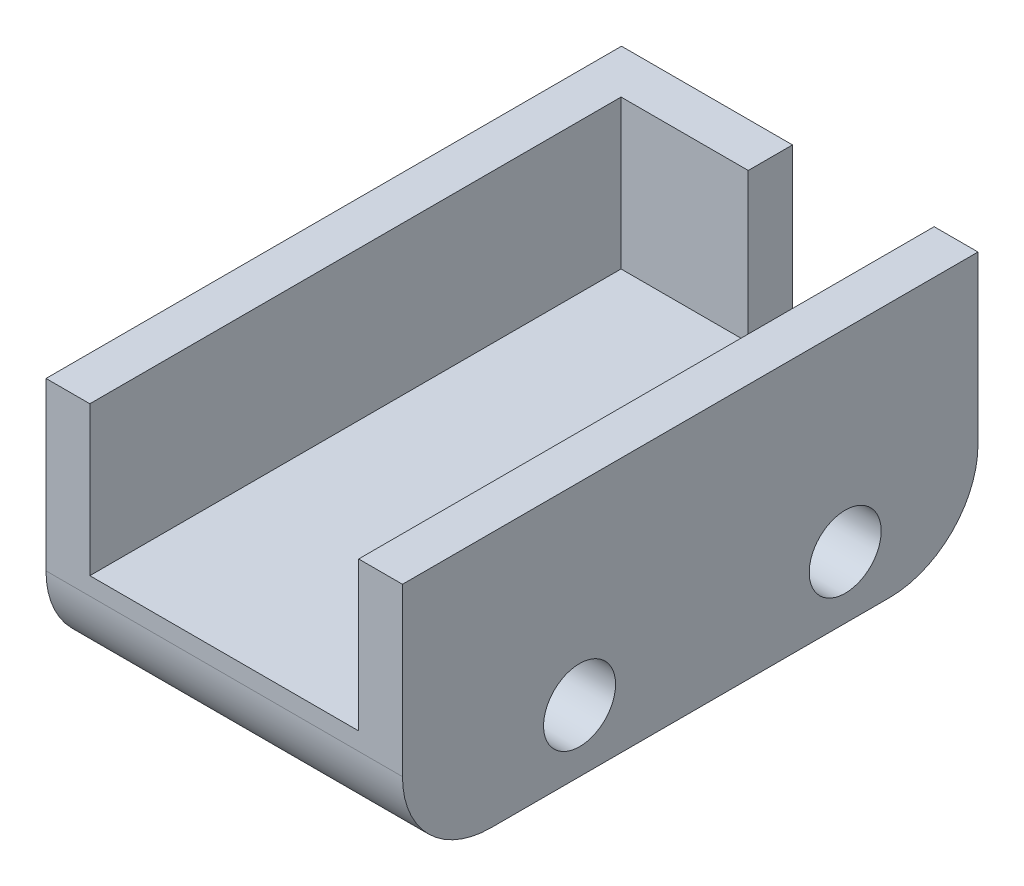
from build123d import *

# Parameters (mm, degrees)
ESQUISSE1_W               = 40.2629848
ESQUISSE1_H               = 26.817935246
BOSS_EXTRU_1_DEPTH        = 65
COQUE1_T                  = -1.5
COQUE1_THICKNESS_2_FACE_W = 63.5
COQUE1_THICKNESS_2_FACE_H = 25.317935246
COQUE1_THICKNESS_2_DEPTH  = 3.45
COQUE1_THICKNESS_3_FACE_W = 25.317935246
COQUE1_THICKNESS_3_FACE_H = 63.5
COQUE1_THICKNESS_3_DEPTH  = 3.45
COQUE1_THICKNESS_4_FACE_W = 63.5
COQUE1_THICKNESS_4_FACE_H = 30.3629848
COQUE1_THICKNESS_4_DEPTH  = 8.5
COQUE1_THICKNESS_5_FACE_W = 30.3629848
COQUE1_THICKNESS_5_FACE_H = 16.817935246
COQUE1_THICKNESS_5_DEPTH  = 3.5
ESQUISSE4_W               = 40.2629848
ESQUISSE4_H               = 65
BOSS_EXTRU_2_DEPTH        = 2
ESQUISSE5_R               = 4.065
ENL_V_MAT_EXTRU_3_DEPTH   = 82.026598076
CONG_2_R                  = 10
CONG_3_R                  = 10
ESQUISSE6_W               = 16
ESQUISSE6_H               = 16.817935246
ENL_V_MAT_EXTRU_4_DEPTH   = 78.073403946


with BuildPart() as part:
    # Esquisse1 → Boss.-Extru.1 (new body)
    with BuildSketch(Plane.XY):
        with Locations((20.1314924, 13.408967623)):
            Rectangle(ESQUISSE1_W, ESQUISSE1_H)
    extrude(amount=BOSS_EXTRU_1_DEPTH)

    # Coque1
    coque1_openings = [part.faces().sort_by_distance(p)[0] for p in [
        (20.1314924, 13.408967623, 65),
        (20.1314924, 26.817935246, 32.5),
    ]]
    offset(amount=COQUE1_T, openings=coque1_openings, kind=Kind.INTERSECTION)

    # Coque1 thickness 2 face (on inner face of the shell) → Coque1 thickness 2 (add)
    with BuildSketch(Plane(origin=(1.5, 14.158967623, 33.25), x_dir=(0, 0, -1), z_dir=(-1, 0, 0))):
        Rectangle(COQUE1_THICKNESS_2_FACE_W, COQUE1_THICKNESS_2_FACE_H)
    extrude(amount=-COQUE1_THICKNESS_2_DEPTH)

    # Coque1 thickness 3 face (on inner face of the shell) → Coque1 thickness 3 (add)
    with BuildSketch(Plane(origin=(38.7629848, 14.158967623, 33.25), x_dir=(0, 1, 0), z_dir=(1, 0, 0))):
        Rectangle(COQUE1_THICKNESS_3_FACE_W, COQUE1_THICKNESS_3_FACE_H)
    extrude(amount=-COQUE1_THICKNESS_3_DEPTH)

    # Coque1 thickness 4 face (on inner face of the shell) → Coque1 thickness 4 (add)
    with BuildSketch(Plane(origin=(20.1314924, 1.5, 33.25), x_dir=(0, 0, -1), z_dir=(0, -1, 0))):
        Rectangle(COQUE1_THICKNESS_4_FACE_W, COQUE1_THICKNESS_4_FACE_H)
    extrude(amount=-COQUE1_THICKNESS_4_DEPTH)

    # Coque1 thickness 5 face (on inner face of the shell) → Coque1 thickness 5 (add)
    with BuildSketch(Plane(origin=(20.1314924, 18.408967623, 1.5), x_dir=(-1, 0, 0), z_dir=(0, 0, -1))):
        Rectangle(COQUE1_THICKNESS_5_FACE_W, COQUE1_THICKNESS_5_FACE_H)
    extrude(amount=-COQUE1_THICKNESS_5_DEPTH)

    # Esquisse4 → Boss.-Extru.2 (add)
    with BuildSketch(Plane.XZ):
        with Locations((20.1314924, 32.5)):
            Rectangle(ESQUISSE4_W, ESQUISSE4_H)
    extrude(amount=BOSS_EXTRU_2_DEPTH)

    # Esquisse5 → Enlèv. mat.-Extru.3 (cut, through all)
    with BuildSketch(Plane(origin=(40.2629848, 0, 0), x_dir=(0, 0, -1), z_dir=(1, 0, 0))):
        with Locations((-15, 5)):
            Circle(ESQUISSE5_R)
        with Locations((-45, 5)):
            Circle(ESQUISSE5_R)
    extrude(amount=-ENL_V_MAT_EXTRU_3_DEPTH, mode=Mode.SUBTRACT)

    # Congé2
    cong_2_edges = [part.edges().sort_by_distance(p)[0] for p in [
        (20.1314924, -2, 0),
    ]]
    fillet(cong_2_edges, radius=CONG_2_R)

    # Congé3
    cong_3_edges = [part.edges().sort_by_distance(p)[0] for p in [
        (20.1314924, -2, 65),
    ]]
    fillet(cong_3_edges, radius=CONG_3_R)

    # Esquisse6 → Enlèv. mat.-Extru.4 (cut, through all)
    with BuildSketch(Plane.XY.offset(5)):
        with Locations((27.3129848, 18.408967623)):
            Rectangle(ESQUISSE6_W, ESQUISSE6_H)
    extrude(amount=-ENL_V_MAT_EXTRU_4_DEPTH, mode=Mode.SUBTRACT)


solid = part.part
